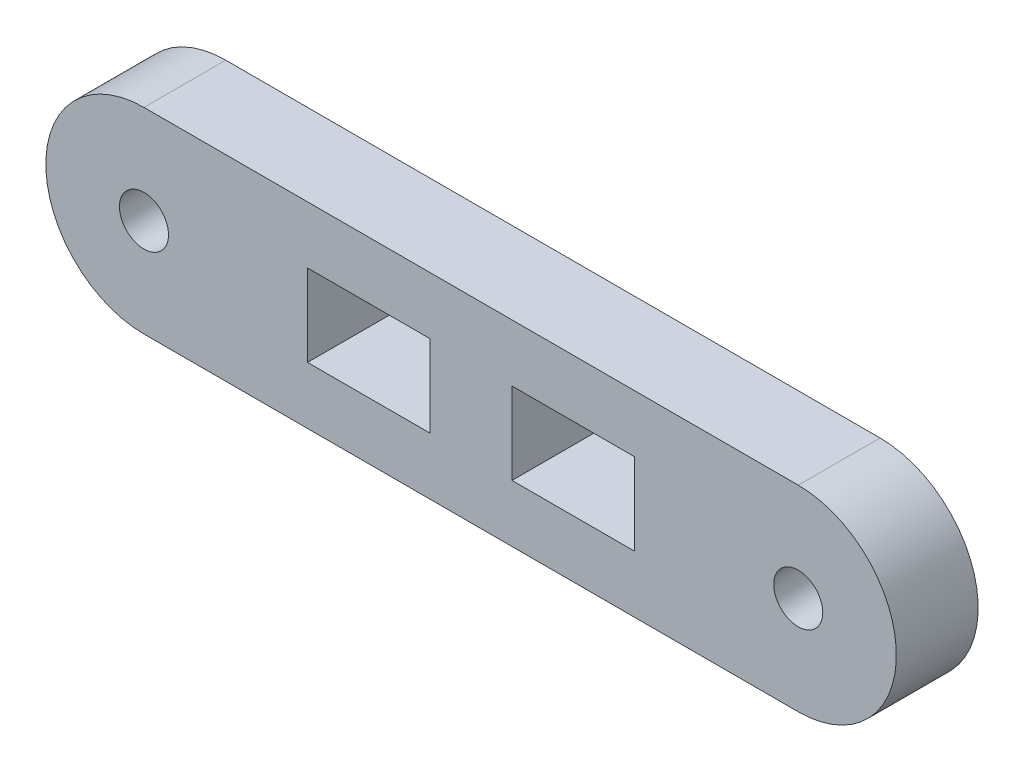
from build123d import *

# Parameters (mm, degrees)
ESQUISSE1_R        = 1.5
ESQUISSE1_W        = 7.5
ESQUISSE1_H        = 5
BOSS_EXTRU_1_DEPTH = 5


with BuildPart() as part:
    # Esquisse1 → Boss.-Extru.1 (new body)
    with BuildSketch(Plane.XY):
        with BuildLine():
            Line((40, -6), (0, -6))
            ThreePointArc((0, -6), (-6, 0), (0, 6))
            Line((0, 6), (40, 6))
            ThreePointArc((40, 6), (46, 0), (40, -6))
        make_face()
        with Locations((40, 0)):
            Circle(ESQUISSE1_R, mode=Mode.SUBTRACT)
        Circle(ESQUISSE1_R, mode=Mode.SUBTRACT)
        with Locations((26.25, 0)):
            Rectangle(ESQUISSE1_W, ESQUISSE1_H, mode=Mode.SUBTRACT)
        with Locations((13.75, 0)):
            Rectangle(ESQUISSE1_W, ESQUISSE1_H, mode=Mode.SUBTRACT)
    extrude(amount=BOSS_EXTRU_1_DEPTH)


solid = part.part
